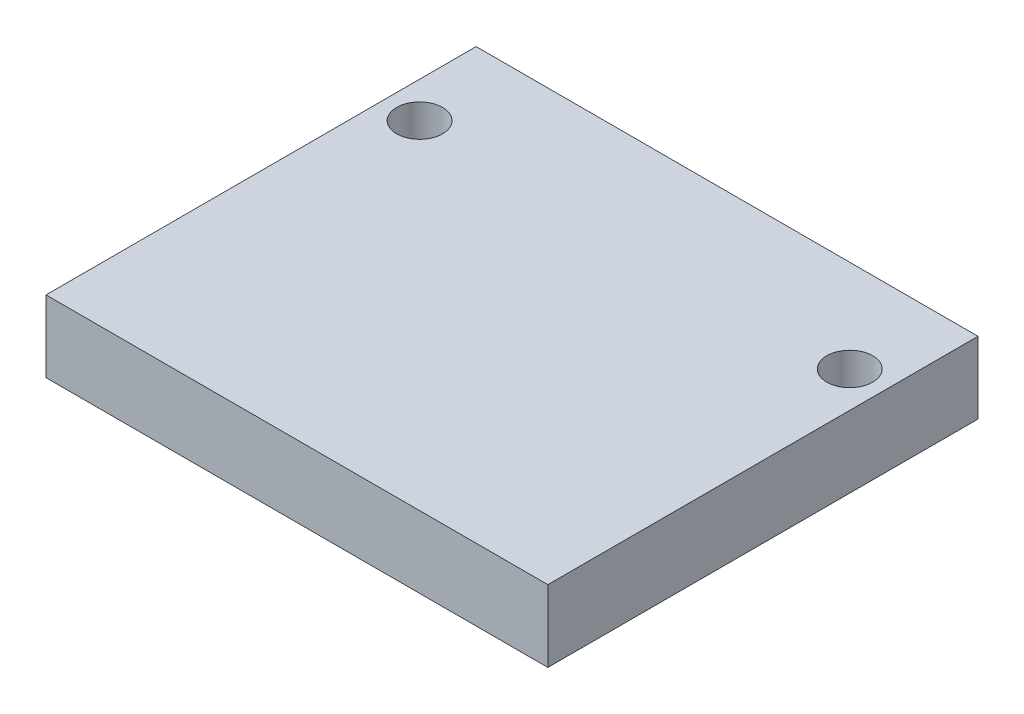
from build123d import *

# Parameters (mm, degrees)
SKETCH_1_W          = 35
SKETCH_1_H          = 5
EXTRUDE_1_DEPTH     = 30
SKETCH_2_R          = 1.6
CUT_EXTRUDE_1_DEPTH = 10


with BuildPart() as part:
    # 草图1 → 凸台-拉伸1 (new body)
    with BuildSketch(Plane.XY):
        Rectangle(SKETCH_1_W, SKETCH_1_H)
    extrude(amount=EXTRUDE_1_DEPTH)

    # 草图2 → 切除-拉伸1 (cut)
    with BuildSketch(Plane(origin=(0, 2.5, 0), x_dir=(1, 0, 0), z_dir=(0, 1, 0))):
        with Locations(Location((15, -6.445040037, 0), (0, 0, 270))):
            Circle(SKETCH_2_R)
        with Locations(Location((-15, -6.445040037, 0), (0, 0, 270))):
            Circle(SKETCH_2_R)
    extrude(amount=-CUT_EXTRUDE_1_DEPTH, mode=Mode.SUBTRACT)


solid = part.part
